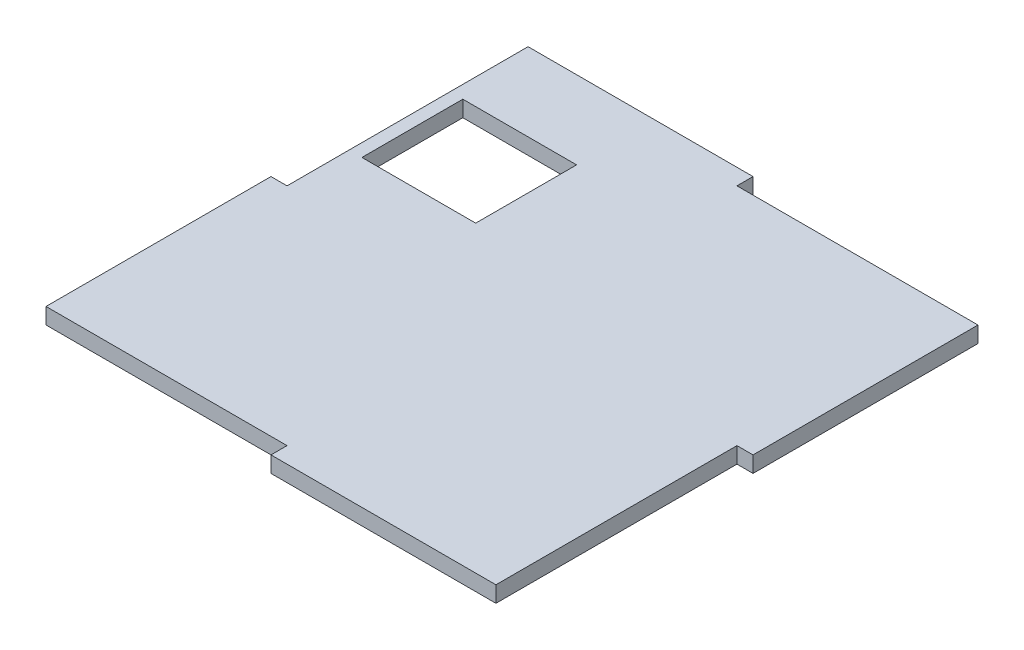
from build123d import *

# Parameters (mm, degrees)
SKETCH1_W           = 44.958
SKETCH1_H           = 39.878
BOSS_EXTRUDE1_DEPTH = 6.35


with BuildPart() as part:
    # Sketch1 → Boss-Extrude1 (new body)
    with BuildSketch(Plane(origin=(0, 0, 0), x_dir=(1, 0, 0), z_dir=(0, 1, 0))):
        Polygon((-109.713615828, 109.288165603), (-109.713615828, 14.038165603), (-116.063615828, 14.038165603), (-116.063615828, -74.861834397), (-20.813615828, -74.861834397), (-20.813615828, -81.211834397), (68.086384172, -81.211834397), (68.086384172, 14.038165603), (74.436384172, 14.038165603), (74.436384172, 102.938165603), (-20.813615828, 102.938165603), (-20.813615828, 109.288165603), align=None)
        with Locations((-82.154615828, 58.488165603)):
            Rectangle(SKETCH1_W, SKETCH1_H, mode=Mode.SUBTRACT)
    extrude(amount=BOSS_EXTRUDE1_DEPTH)


solid = part.part
